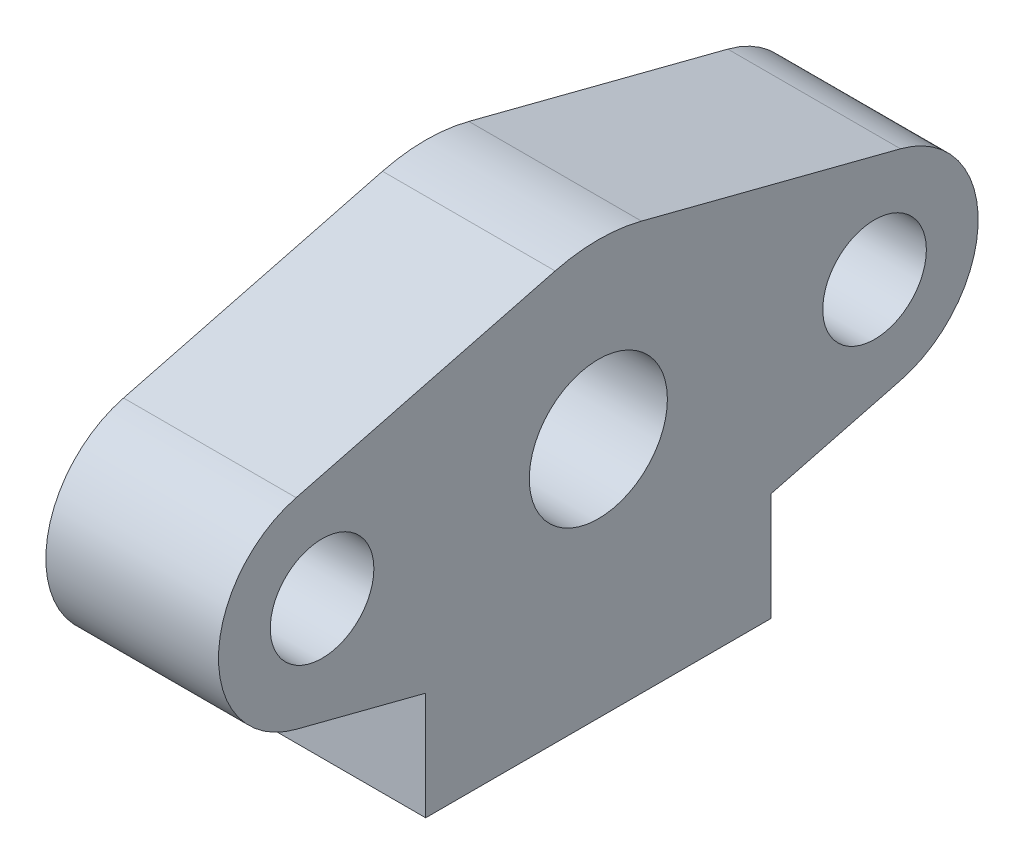
from build123d import *

# Parameters (mm, degrees)
SKETCH1_R           = 4
SKETCH1_R_2         = 3
BOSS_EXTRUDE1_DEPTH = 10


with BuildPart() as part:
    # Sketch1 → Boss-Extrude1 (new body)
    with BuildSketch(Plane(origin=(0, 0, 0), x_dir=(0, 0, -1), z_dir=(1, 0, 0))):
        with BuildLine():
            Line((-10, -7.745966692), (-10, -14))
            Line((-10, -14), (10, -14))
            Line((10, -14), (10, -7.745966692))
            Line((10, -7.745966692), (17.5, -5.809475019))
            ThreePointArc((17.5, -5.809475019), (22, 0), (17.5, 5.809475019))
            Line((17.5, 5.809475019), (2.5, 9.682458366))
            ThreePointArc((2.5, 9.682458366), (0, 10), (-2.5, 9.682458366))
            Line((-2.5, 9.682458366), (-17.5, 5.809475019))
            ThreePointArc((-17.5, 5.809475019), (-22, 0), (-17.5, -5.809475019))
            Line((-17.5, -5.809475019), (-10, -7.745966692))
        make_face()
        Circle(SKETCH1_R, mode=Mode.SUBTRACT)
        with Locations((16, 0)):
            Circle(SKETCH1_R_2, mode=Mode.SUBTRACT)
        with Locations((-16, 0)):
            Circle(SKETCH1_R_2, mode=Mode.SUBTRACT)
    extrude(amount=BOSS_EXTRUDE1_DEPTH)


solid = part.part
